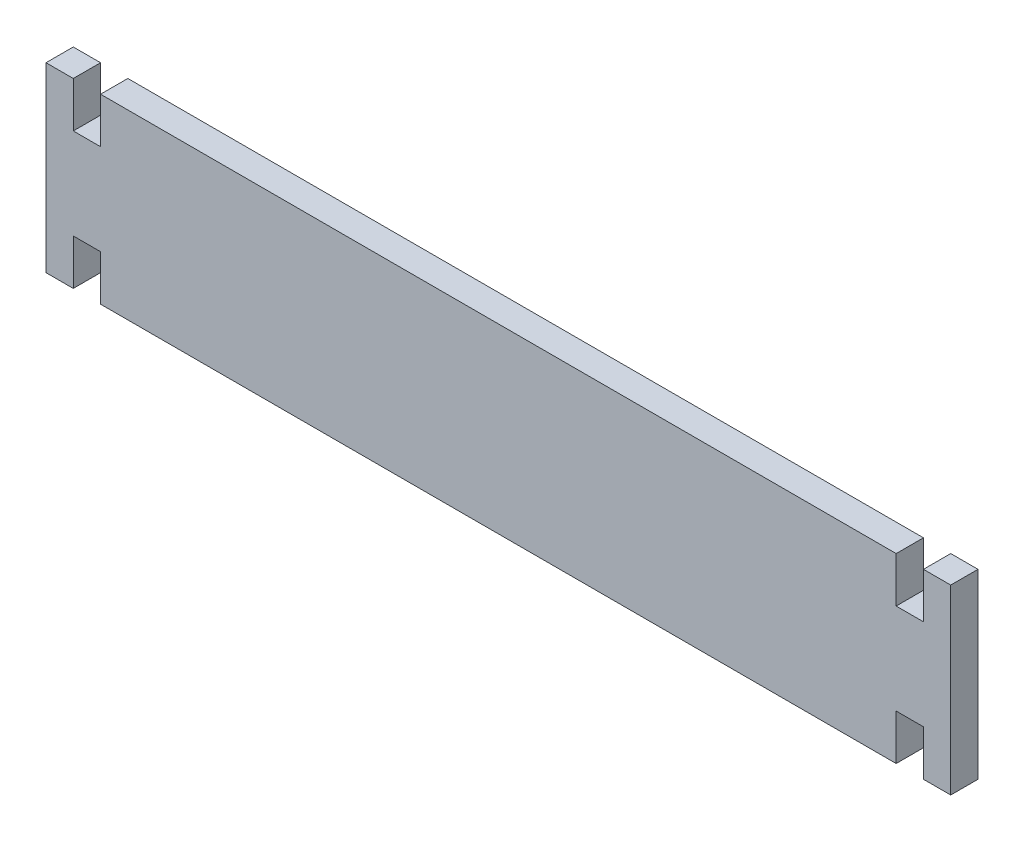
from build123d import *

# Parameters (mm, degrees)
SKETCH1_W            = 199
SKETCH1_H            = 40
BOSS_EXTRUDE1_DEPTH  = 6
SKETCH2_W            = 6
SKETCH2_H            = 10
CUT_EXTRUDE1_DEPTH   = 204.068953806
LPATTERN1_COUNT      = 2
LPATTERN1_PITCH      = 181
LPATTERN1_COUNT_DIR2 = 2
LPATTERN1_PITCH_DIR2 = 30


with BuildPart() as part:
    # Sketch1 → Boss-Extrude1 (new body)
    with BuildSketch(Plane.XY):
        with Locations((-99.5, 20)):
            Rectangle(SKETCH1_W, SKETCH1_H)
    extrude(amount=BOSS_EXTRUDE1_DEPTH)

    # Sketch2 → Cut-Extrude1 (cut, through all)
    with BuildSketch(Plane.XY.offset(6)):
        with Locations((-190, 35)):
            Rectangle(SKETCH2_W, SKETCH2_H)
    cut_extrude1 = extrude(amount=-CUT_EXTRUDE1_DEPTH, mode=Mode.SUBTRACT)

    # LPattern1: Cut-Extrude1 2 × 2
    with Locations(*[(i * LPATTERN1_PITCH, -j * LPATTERN1_PITCH_DIR2, 0) for i in range(LPATTERN1_COUNT) for j in range(LPATTERN1_COUNT_DIR2) if (i, j) != (0, 0)]):
        add(cut_extrude1, mode=Mode.SUBTRACT)


solid = part.part
